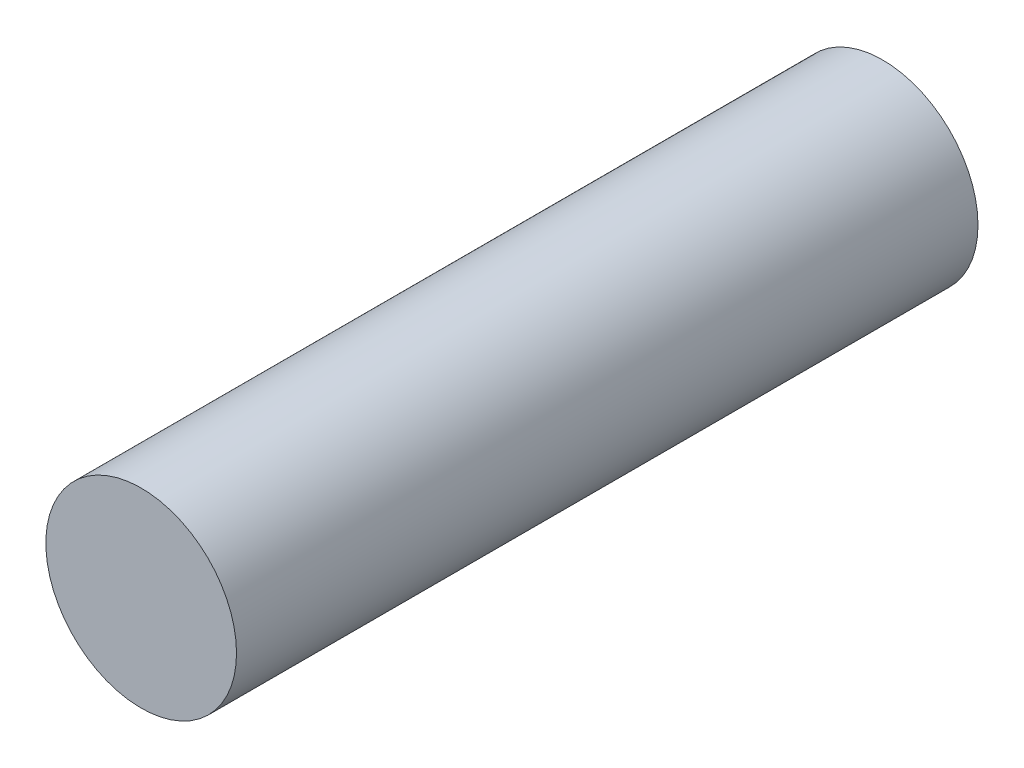
from build123d import *

# Parameters (mm, degrees)
SKETCH1_R           = 9
BOSS_EXTRUDE1_DEPTH = 70


with BuildPart() as part:
    # Sketch1 → Boss-Extrude1 (new body)
    with BuildSketch(Plane.XY):
        Circle(SKETCH1_R)
    extrude(amount=BOSS_EXTRUDE1_DEPTH)


solid = part.part
